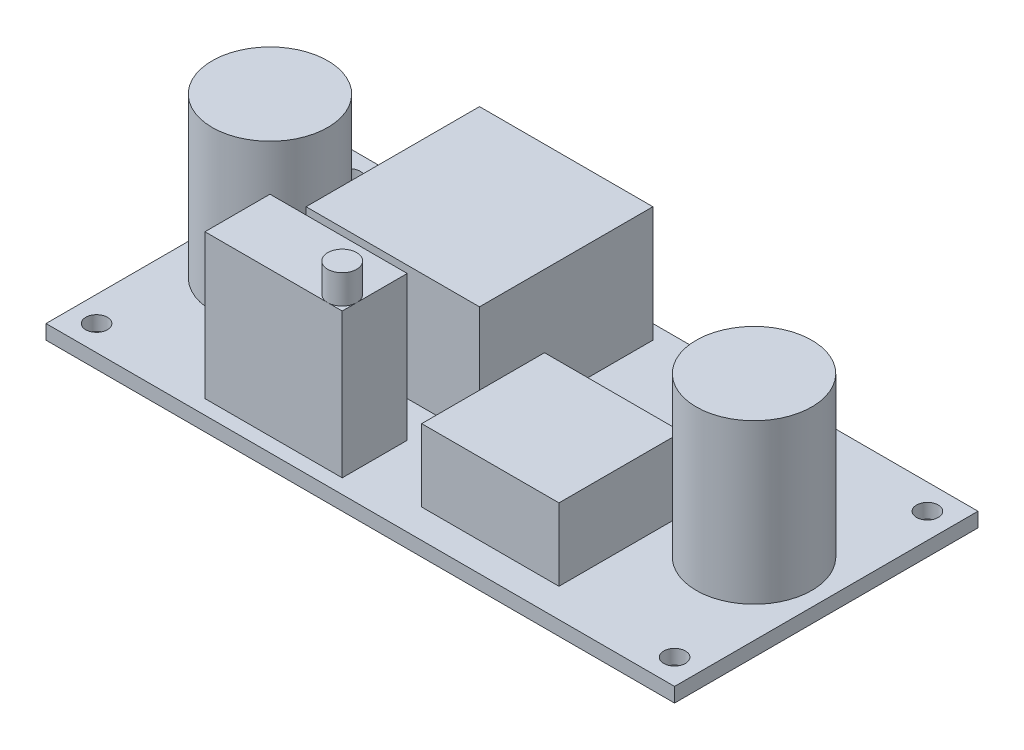
from build123d import *

# Parameters (mm, degrees)
SKETCH_1_W      = 43.5
SKETCH_1_H      = 21
SKETCH_1_R      = 0.75
EXTRUDE_1_DEPTH = 1
SKETCH_1_3_R    = 4
EXTRUDE_2_DEPTH = 11
SKETCH_1_4_W    = 9.5
SKETCH_1_4_H    = 8.5
EXTRUDE_3_DEPTH = 5
SKETCH_1_5_W    = 9.5
SKETCH_1_5_H    = 4.5
EXTRUDE_4_DEPTH = 10
SKETCH_1_6_W    = 12
SKETCH_1_6_H    = 12
EXTRUDE_5_DEPTH = 8
SKETCH_2_R      = 1
EXTRUDE_6_DEPTH = 2


with BuildPart() as part:
    # Эскиз1 → Бобышка-Вытянуть1 (new body)
    with BuildSketch(Plane(origin=(0, 0, 0), x_dir=(1, 0, 0), z_dir=(0, 1, 0))):
        Rectangle(SKETCH_1_W, SKETCH_1_H)
        with Locations((-20, -8.75)):
            Circle(SKETCH_1_R, mode=Mode.SUBTRACT)
        with Locations((20, -8.75)):
            Circle(SKETCH_1_R, mode=Mode.SUBTRACT)
        with Locations((-20, 8.75)):
            Circle(SKETCH_1_R, mode=Mode.SUBTRACT)
        with Locations((20, 8.75)):
            Circle(SKETCH_1_R, mode=Mode.SUBTRACT)
    extrude(amount=-EXTRUDE_1_DEPTH)

    # Эскиз1<3> → Бобышка-Вытянуть2 (add)
    with BuildSketch(Plane(origin=(0, 0, 0), x_dir=(1, 0, 0), z_dir=(0, 1, 0))):
        with Locations((-16.75, 0)):
            Circle(SKETCH_1_3_R)
        with Locations((16.75, 0)):
            Circle(SKETCH_1_3_R)
    extrude(amount=EXTRUDE_2_DEPTH)

    # Эскиз1<4> → Бобышка-Вытянуть3 (add)
    with BuildSketch(Plane(origin=(0, 0, 0), x_dir=(1, 0, 0), z_dir=(0, 1, 0))):
        with Locations((7, -4.25)):
            Rectangle(SKETCH_1_4_W, SKETCH_1_4_H)
    extrude(amount=EXTRUDE_3_DEPTH)

    # Эскиз1<5> → Бобышка-Вытянуть4 (add)
    with BuildSketch(Plane(origin=(0, 0, 0), x_dir=(1, 0, 0), z_dir=(0, 1, 0))):
        with Locations((-7, -7.25)):
            Rectangle(SKETCH_1_5_W, SKETCH_1_5_H)
    extrude(amount=EXTRUDE_4_DEPTH)

    # Эскиз1<6> → Бобышка-Вытянуть5 (add)
    with BuildSketch(Plane(origin=(0, 0, 0), x_dir=(1, 0, 0), z_dir=(0, 1, 0))):
        with Locations((-5.75, 3.5)):
            Rectangle(SKETCH_1_6_W, SKETCH_1_6_H)
    extrude(amount=EXTRUDE_5_DEPTH)

    # Эскиз2 → Бобышка-Вытянуть6 (add)
    with BuildSketch(Plane(origin=(0, 10, 0), x_dir=(1, 0, 0), z_dir=(0, 1, 0))):
        with Locations((-3.25, -8.5)):
            Circle(SKETCH_2_R)
    extrude(amount=EXTRUDE_6_DEPTH)


solid = part.part
